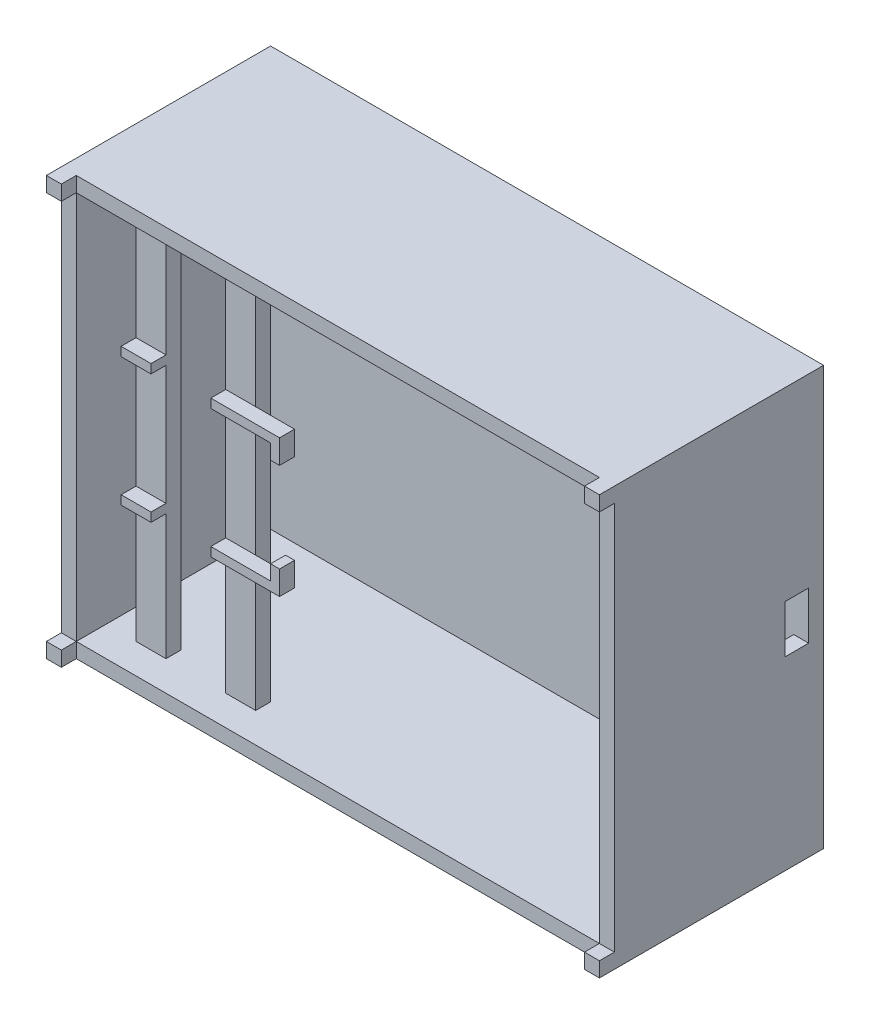
from build123d import *

# Parameters (mm, degrees)
SKETCH1_W           = 185
SKETCH1_H           = 140
BOSS_EXTRUDE1_DEPTH = 70
SHELL1_T            = -5
BOSS_EXTRUDE2_START = 50
SKETCH2_W           = 10
SKETCH2_H           = 130
BOSS_EXTRUDE2_DEPTH = 5
SKETCH3_W           = 10
SKETCH3_H           = 3
BOSS_EXTRUDE6_DEPTH = 5
SKETCH5_W           = 8
SKETCH5_H           = 16
CUT_EXTRUDE1_DEPTH  = 5
SKETCH6_W           = 5
SKETCH6_H           = 5
BOSS_EXTRUDE7_DEPTH = 5


with BuildPart() as part:
    # Sketch1 → Boss-Extrude1 (new body)
    with BuildSketch(Plane.XY):
        Rectangle(SKETCH1_W, SKETCH1_H)
    extrude(amount=BOSS_EXTRUDE1_DEPTH)

    # Shell1
    shell1_openings = [part.faces().sort_by_distance(p)[0] for p in [
        (0, 0, 70),
    ]]
    offset(amount=SHELL1_T, openings=shell1_openings, kind=Kind.INTERSECTION)

    # Sketch2 → Boss-Extrude2 (add)
    with BuildSketch(Plane.XY.offset(5).offset(BOSS_EXTRUDE2_START)):
        with Locations((-72.5, 0)):
            Rectangle(SKETCH2_W, SKETCH2_H)
        with Locations((-42.5, 0)):
            Rectangle(SKETCH2_W, SKETCH2_H)
    extrude(amount=BOSS_EXTRUDE2_DEPTH)

    # Sketch3 → Boss-Extrude6 (add)
    with BuildSketch(Plane.XY.offset(60)):
        Polygon((-47.5, 20), (-27.5, 20), (-27.5, 15), (-24.5, 15), (-24.5, 23), (-47.5, 23), align=None)
        Polygon((-47.5, -20), (-27.5, -20), (-27.5, -15), (-24.5, -15), (-24.5, -23), (-47.5, -23), align=None)
        with Locations((-72.5, 21.5)):
            Rectangle(SKETCH3_W, SKETCH3_H)
        with Locations((-72.5, -21.5)):
            Rectangle(SKETCH3_W, SKETCH3_H)
    extrude(amount=BOSS_EXTRUDE6_DEPTH)

    # Sketch5 → Cut-Extrude1 (cut)
    with BuildSketch(Plane(origin=(92.5, 0, 0), x_dir=(0, 0, -1), z_dir=(1, 0, 0))):
        with Locations((-9, 0)):
            Rectangle(SKETCH5_W, SKETCH5_H)
    extrude(amount=-CUT_EXTRUDE1_DEPTH, mode=Mode.SUBTRACT)

    # Sketch6 → Boss-Extrude7 (add)
    with BuildSketch(Plane.XY.offset(70)):
        with Locations((-90, 67.5)):
            Rectangle(SKETCH6_W, SKETCH6_H)
        with Locations((-90, -67.5)):
            Rectangle(SKETCH6_W, SKETCH6_H)
        with Locations((90, -67.5)):
            Rectangle(SKETCH6_W, SKETCH6_H)
        with Locations((90, 67.5)):
            Rectangle(SKETCH6_W, SKETCH6_H)
    extrude(amount=BOSS_EXTRUDE7_DEPTH)


solid = part.part
